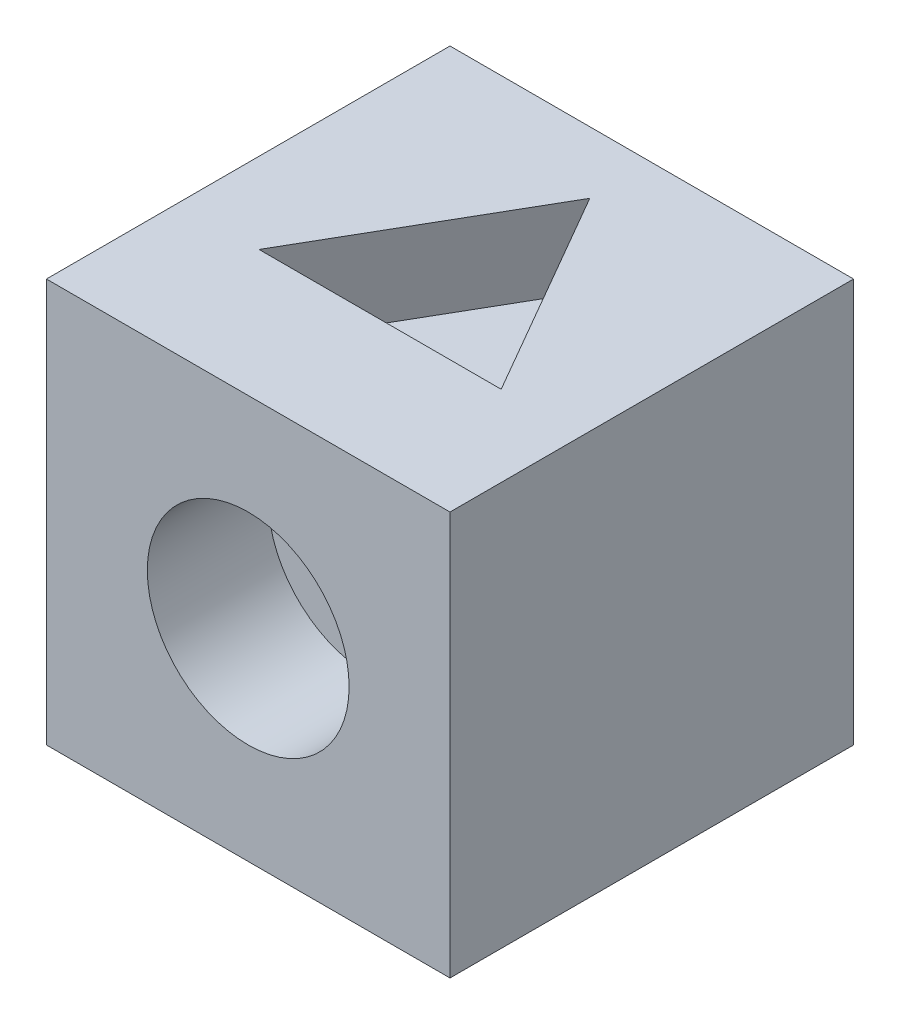
from build123d import *

# Parameters (mm, degrees)
SKETCH1_W           = 100
SKETCH1_H           = 100
BOSS_EXTRUDE1_DEPTH = 100
SKETCH2_R           = 25
CUT_EXTRUDE1_DEPTH  = 30
CUT_EXTRUDE2_DEPTH  = 20


with BuildPart() as part:
    # Sketch1 → Boss-Extrude1 (new body)
    with BuildSketch(Plane(origin=(0, 0, 0), x_dir=(1, 0, 0), z_dir=(0, 1, 0))):
        Rectangle(SKETCH1_W, SKETCH1_H)
    extrude(amount=BOSS_EXTRUDE1_DEPTH)

    # Sketch2 → Cut-Extrude1 (cut)
    with BuildSketch(Plane.XY.offset(50)):
        with Locations((0, 50)):
            Circle(SKETCH2_R)
    extrude(amount=-CUT_EXTRUDE1_DEPTH, mode=Mode.SUBTRACT)

    # Sketch3 → Cut-Extrude2 (cut)
    with BuildSketch(Plane(origin=(0, 100, 0), x_dir=(1, 0, 0), z_dir=(0, 1, 0))):
        Polygon((0, 34.641016151), (-30, -17.320508076), (30, -17.320508076), align=None)
    extrude(amount=-CUT_EXTRUDE2_DEPTH, mode=Mode.SUBTRACT)


solid = part.part
